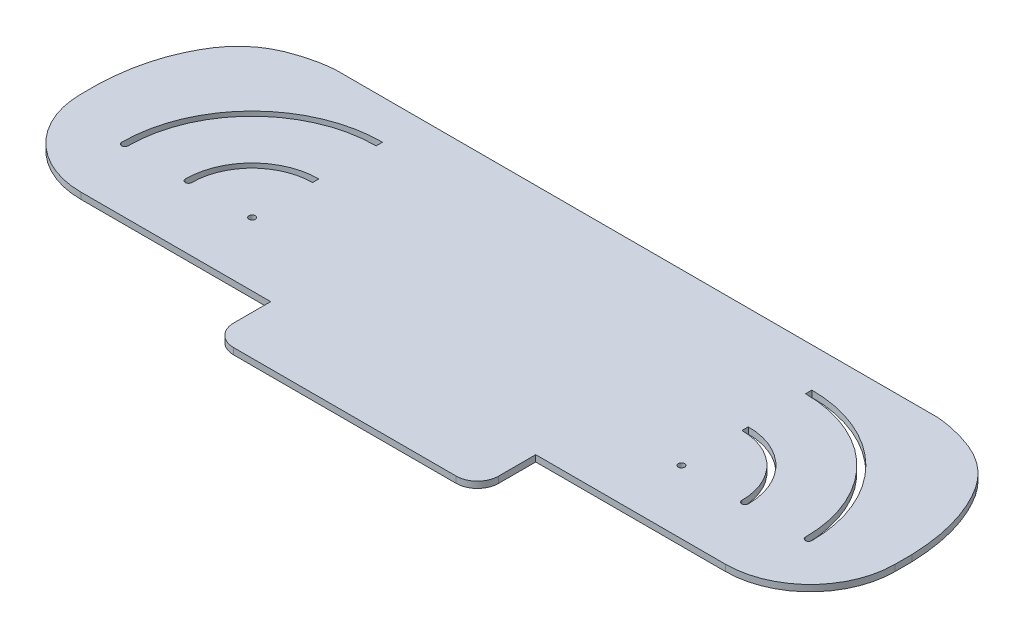
from build123d import *

# Parameters (mm, degrees)
BOSS_EXTRUDE1_DEPTH      = 1.5
BOSS_EXTRUDE1_DEPTH_BACK = 1.5
SKETCH1_W                = 125
SKETCH1_H                = 27.5
FILLET1_R                = 10
FILLET2_R                = 10
BOSS_EXTRUDE2_DEPTH      = 1.5
BOSS_EXTRUDE2_DEPTH_BACK = 1.5
SKETCH3_W                = 384
SKETCH3_H                = 110
FILLET3_R                = 40
FILLET4_R                = 40
CUT_EXTRUDE1_DEPTH       = 229.444878472
FILLET5_R                = 40
FILLET5_OF_MIRROR1_R     = 40
SKETCH5_R                = 1.5
CUT_EXTRUDE2_DEPTH       = 229.444878611
SKETCH8_W                = 3
SKETCH8_H                = 3
CUT_REVOLVE1_ANGLE       = 90


with BuildPart() as part:
    # Sketch1 → Boss-Extrude1 (new, two sides: drawn at the far end of the back side and taken through both)
    with BuildSketch(Plane(origin=(0, 0, 0), x_dir=(1, 0, 0), z_dir=(0, 1, 0)).offset(-BOSS_EXTRUDE1_DEPTH_BACK)):
        Rectangle(SKETCH1_W, SKETCH1_H)
    extrude(amount=BOSS_EXTRUDE1_DEPTH + BOSS_EXTRUDE1_DEPTH_BACK)

    # Fillet1
    fillet1_edges = [part.edges().sort_by_distance(p)[0] for p in [
        (-62.5, 0, 13.75),
    ]]
    fillet(fillet1_edges, radius=FILLET1_R)

    # Fillet2
    fillet2_edges = [part.edges().sort_by_distance(p)[0] for p in [
        (62.5, 0, 13.75),
    ]]
    fillet(fillet2_edges, radius=FILLET2_R)

    # Sketch3 → Boss-Extrude2 (add, two sides: drawn at the far end of the back side and taken through both)
    with BuildSketch(Plane(origin=(0, 0, 0), x_dir=(1, 0, 0), z_dir=(0, 1, 0)).offset(-BOSS_EXTRUDE2_DEPTH_BACK)):
        with Locations((0, 68.75)):
            Rectangle(SKETCH3_W, SKETCH3_H)
    extrude(amount=BOSS_EXTRUDE2_DEPTH + BOSS_EXTRUDE2_DEPTH_BACK)

    # Fillet3
    fillet3_edges = [part.edges().sort_by_distance(p)[0] for p in [
        (192, 0, -13.75),
    ]]
    fillet(fillet3_edges, radius=FILLET3_R)

    # Fillet4
    fillet4_edges = [part.edges().sort_by_distance(p)[0] for p in [
        (-192, 0, -13.75),
    ]]
    fillet(fillet4_edges, radius=FILLET4_R)

    # Sketch4 → Cut-Extrude1 (cut, through all)
    with BuildSketch(Plane(origin=(0, 1.5, 0), x_dir=(1, 0, 0), z_dir=(0, 1, 0))):
        with BuildLine():
            Line((-160.390648589, 123.75), (-192, 123.75))
            Line((-192, 123.75), (-192, 61.83266327))
            add(Edge.make_bspline(
                [(-192, 61.83266327), (-190.899009452, 93.759296174), (-172, 113.75)],
                knots=[0.088627388, 0.088627388, 0.088627388, 0.804978643, 0.804978643, 0.804978643], degree=2))
            add(Edge.make_bspline(
                [(-172, 113.75), (-166.85488377, 119.192321989), (-160.390648589, 123.75)],
                knots=[0.804978643, 0.804978643, 0.804978643, 1, 1, 1], degree=2))
        make_face()
        with BuildLine():
            Line((-142, 123.75), (-160.390648589, 123.75))
            add(Edge.make_bspline(
                [(-172, 113.75), (-166.85488377, 119.192321989), (-160.390648589, 123.75)],
                knots=[0.804978643, 0.804978643, 0.804978643, 1, 1, 1], degree=2))
            add(Edge.make_bspline(
                [(-172, 113.75), (-157.601214668, 122.454851717), (-142, 123.75)],
                knots=[0, 0, 0, 0.740970343, 0.740970343, 0.740970343], degree=2))
        make_face()
    cut_extrude1 = extrude(amount=-CUT_EXTRUDE1_DEPTH, mode=Mode.SUBTRACT)

    # Fillet5
    fillet5_edges = [part.edges().sort_by_distance(p)[0] for p in [
        (-172, 0, -113.75),
    ]]
    fillet(fillet5_edges, radius=FILLET5_R)

    # Mirror1: Cut-Extrude1 across plane
    add(cut_extrude1.mirror(Plane(origin=(0, 0, 0), x_dir=(0, 0, 1), z_dir=(1, 0, 0))), mode=Mode.SUBTRACT)

    # Fillet5 of Mirror1
    fillet5_of_mirror1_edges = [part.edges().sort_by_distance(p)[0] for p in [
        (172, 0, -113.75),
    ]]
    fillet(fillet5_of_mirror1_edges, radius=FILLET5_OF_MIRROR1_R)

    # Sketch5 → Cut-Extrude2 (cut, through all)
    with BuildSketch(Plane(origin=(0, 1.5, 0), x_dir=(1, 0, 0), z_dir=(0, 1, 0))):
        with Locations(Location((-101.25, 43.75, 0), (0, 0, 270))):
            Circle(SKETCH5_R)
        with Locations(Location((-131.25, 43.75, 0), (0, 0, 270))):
            Circle(SKETCH5_R)
        with Locations(Location((-161.25, 43.75, 0), (0, 0, 270))):
            Circle(SKETCH5_R)
    cut_extrude2 = extrude(amount=-CUT_EXTRUDE2_DEPTH, mode=Mode.SUBTRACT)

    # Sketch8 → Cut-Revolve1 (revolve, cut)
    with BuildSketch(Plane.XY.offset(-43.75)):
        with Locations((-131.25, 0)):
            Rectangle(SKETCH8_W, SKETCH8_H)
        with Locations((-161.25, 0)):
            Rectangle(SKETCH8_W, SKETCH8_H)
    cut_revolve1 = revolve(axis=Axis((-101.25, -1.5, -43.75), (0, -1, 0)), revolution_arc=CUT_REVOLVE1_ANGLE, mode=Mode.SUBTRACT)

    # Mirror2: Cut-Extrude2, Cut-Revolve1 across plane
    add(cut_extrude2.mirror(Plane(origin=(0, 0, 0), x_dir=(0, 0, 1), z_dir=(1, 0, 0))), mode=Mode.SUBTRACT)
    add(cut_revolve1.mirror(Plane(origin=(0, 0, 0), x_dir=(0, 0, 1), z_dir=(1, 0, 0))), mode=Mode.SUBTRACT)


solid = part.part
